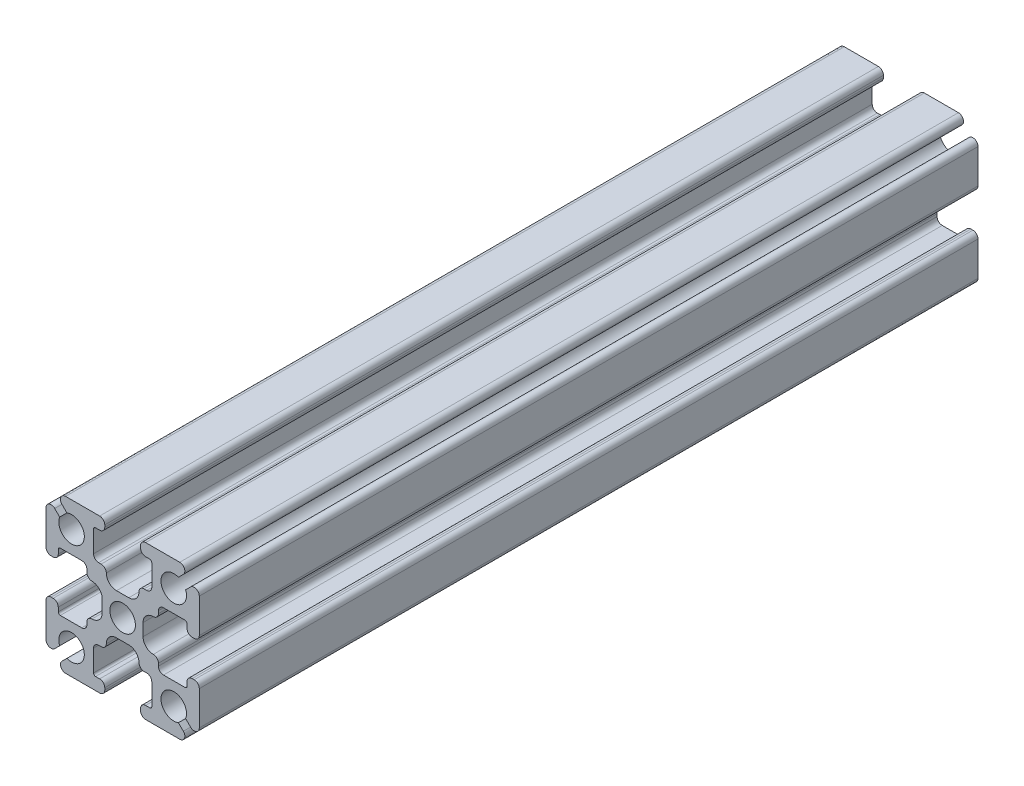
from build123d import *

# Parameters (mm, degrees)
SKETCH1_R           = 1.25
BOSS_EXTRUDE1_DEPTH = 76.2


with BuildPart() as part:
    # Sketch1 → Boss-Extrude1 (new body)
    with BuildSketch(Plane.XY):
        with BuildLine():
            Line((6.646446609, 5.939339828), (6.163645978, 5.456539197))
            ThreePointArc((6.163645978, 5.456539197), (4.116116524, 4.116116524), (5.456539197, 6.163645978))
            Line((5.456539197, 6.163645978), (5.939339828, 6.646446609))
            ThreePointArc((5.939339828, 6.646446609), (6.047726204, 7.191341716), (5.585786438, 7.5))
            Line((5.585786438, 7.5), (2.25, 7.5))
            ThreePointArc((2.25, 7.5), (1.896446609, 7.353553391), (1.75, 7))
            Line((1.75, 7), (1.75, 6.8))
            ThreePointArc((1.75, 6.8), (1.896446609, 6.446446609), (2.25, 6.3))
            Line((2.25, 6.3), (2.65, 6.3))
            ThreePointArc((2.65, 6.3), (2.791421356, 6.241421356), (2.85, 6.1))
            Line((2.85, 6.1), (2.85, 4))
            ThreePointArc((2.85, 4), (2.703553391, 3.646446609), (2.35, 3.5))
            Line((2.35, 3.5), (2.1, 3.5))
            ThreePointArc((2.1, 3.5), (1.746446609, 3.353553391), (1.6, 3))
            ThreePointArc((1.6, 3), (1.307106781, 2.292893219), (0.6, 2))
            Line((0.6, 2), (-0.6, 2))
            ThreePointArc((-0.6, 2), (-1.307106781, 2.292893219), (-1.6, 3))
            ThreePointArc((-1.6, 3), (-1.746446609, 3.353553391), (-2.1, 3.5))
            Line((-2.1, 3.5), (-2.35, 3.5))
            ThreePointArc((-2.35, 3.5), (-2.703553391, 3.646446609), (-2.85, 4))
            Line((-2.85, 4), (-2.85, 6.1))
            ThreePointArc((-2.85, 6.1), (-2.791421356, 6.241421356), (-2.65, 6.3))
            Line((-2.65, 6.3), (-2.25, 6.3))
            ThreePointArc((-2.25, 6.3), (-1.896446609, 6.446446609), (-1.75, 6.8))
            Line((-1.75, 6.8), (-1.75, 7))
            ThreePointArc((-1.75, 7), (-1.896446609, 7.353553391), (-2.25, 7.5))
            Line((-2.25, 7.5), (-5.585786438, 7.5))
            ThreePointArc((-5.585786438, 7.5), (-6.047726204, 7.191341716), (-5.939339828, 6.646446609))
            Line((-5.939339828, 6.646446609), (-5.456539197, 6.163645978))
            ThreePointArc((-5.456539197, 6.163645978), (-4.116116524, 4.116116524), (-6.163645978, 5.456539197))
            Line((-6.163645978, 5.456539197), (-6.646446609, 5.939339828))
            ThreePointArc((-6.646446609, 5.939339828), (-7.191341716, 6.047726204), (-7.5, 5.585786438))
            Line((-7.5, 5.585786438), (-7.5, 2.25))
            ThreePointArc((-7.5, 2.25), (-7.353553391, 1.896446609), (-7, 1.75))
            Line((-7, 1.75), (-6.8, 1.75))
            ThreePointArc((-6.8, 1.75), (-6.446446609, 1.896446609), (-6.3, 2.25))
            Line((-6.3, 2.25), (-6.3, 2.65))
            ThreePointArc((-6.3, 2.65), (-6.241421356, 2.791421356), (-6.1, 2.85))
            Line((-6.1, 2.85), (-4, 2.85))
            ThreePointArc((-4, 2.85), (-3.646446609, 2.703553391), (-3.5, 2.35))
            Line((-3.5, 2.35), (-3.5, 2.1))
            ThreePointArc((-3.5, 2.1), (-3.353553391, 1.746446609), (-3, 1.6))
            ThreePointArc((-3, 1.6), (-2.292893219, 1.307106781), (-2, 0.6))
            Line((-2, 0.6), (-2, -0.6))
            ThreePointArc((-2, -0.6), (-2.292893219, -1.307106781), (-3, -1.6))
            ThreePointArc((-3, -1.6), (-3.353553391, -1.746446609), (-3.5, -2.1))
            Line((-3.5, -2.1), (-3.5, -2.35))
            ThreePointArc((-3.5, -2.35), (-3.646446609, -2.703553391), (-4, -2.85))
            Line((-4, -2.85), (-6.1, -2.85))
            ThreePointArc((-6.1, -2.85), (-6.241421356, -2.791421356), (-6.3, -2.65))
            Line((-6.3, -2.65), (-6.3, -2.25))
            ThreePointArc((-6.3, -2.25), (-6.446446609, -1.896446609), (-6.8, -1.75))
            Line((-6.8, -1.75), (-7, -1.75))
            ThreePointArc((-7, -1.75), (-7.353553391, -1.896446609), (-7.5, -2.25))
            Line((-7.5, -2.25), (-7.5, -5.585786438))
            ThreePointArc((-7.5, -5.585786438), (-7.191341716, -6.047726204), (-6.646446609, -5.939339828))
            Line((-6.646446609, -5.939339828), (-6.163645978, -5.456539197))
            ThreePointArc((-6.163645978, -5.456539197), (-4.116116524, -4.116116524), (-5.456539197, -6.163645978))
            Line((-5.456539197, -6.163645978), (-5.939339828, -6.646446609))
            ThreePointArc((-5.939339828, -6.646446609), (-6.047726204, -7.191341716), (-5.585786438, -7.5))
            Line((-5.585786438, -7.5), (-2.25, -7.5))
            ThreePointArc((-2.25, -7.5), (-1.896446609, -7.353553391), (-1.75, -7))
            Line((-1.75, -7), (-1.75, -6.8))
            ThreePointArc((-1.75, -6.8), (-1.896446609, -6.446446609), (-2.25, -6.3))
            Line((-2.25, -6.3), (-2.65, -6.3))
            ThreePointArc((-2.65, -6.3), (-2.791421356, -6.241421356), (-2.85, -6.1))
            Line((-2.85, -6.1), (-2.85, -4))
            ThreePointArc((-2.85, -4), (-2.703553391, -3.646446609), (-2.35, -3.5))
            Line((-2.35, -3.5), (-2.1, -3.5))
            ThreePointArc((-2.1, -3.5), (-1.746446609, -3.353553391), (-1.6, -3))
            ThreePointArc((-1.6, -3), (-1.307106781, -2.292893219), (-0.6, -2))
            Line((-0.6, -2), (0.6, -2))
            ThreePointArc((0.6, -2), (1.307106781, -2.292893219), (1.6, -3))
            ThreePointArc((1.6, -3), (1.746446609, -3.353553391), (2.1, -3.5))
            Line((2.1, -3.5), (2.35, -3.5))
            ThreePointArc((2.35, -3.5), (2.703553391, -3.646446609), (2.85, -4))
            Line((2.85, -4), (2.85, -6.1))
            ThreePointArc((2.85, -6.1), (2.791421356, -6.241421356), (2.65, -6.3))
            Line((2.65, -6.3), (2.25, -6.3))
            ThreePointArc((2.25, -6.3), (1.896446609, -6.446446609), (1.75, -6.8))
            Line((1.75, -6.8), (1.75, -7))
            ThreePointArc((1.75, -7), (1.896446609, -7.353553391), (2.25, -7.5))
            Line((2.25, -7.5), (5.585786438, -7.5))
            ThreePointArc((5.585786438, -7.5), (6.047726204, -7.191341716), (5.939339828, -6.646446609))
            Line((5.939339828, -6.646446609), (5.456539197, -6.163645978))
            ThreePointArc((5.456539197, -6.163645978), (4.116116524, -4.116116524), (6.163645978, -5.456539197))
            Line((6.163645978, -5.456539197), (6.646446609, -5.939339828))
            ThreePointArc((6.646446609, -5.939339828), (7.191341716, -6.047726204), (7.5, -5.585786438))
            Line((7.5, -5.585786438), (7.5, -2.25))
            ThreePointArc((7.5, -2.25), (7.353553391, -1.896446609), (7, -1.75))
            Line((7, -1.75), (6.8, -1.75))
            ThreePointArc((6.8, -1.75), (6.446446609, -1.896446609), (6.3, -2.25))
            Line((6.3, -2.25), (6.3, -2.65))
            ThreePointArc((6.3, -2.65), (6.241421356, -2.791421356), (6.1, -2.85))
            Line((6.1, -2.85), (4, -2.85))
            ThreePointArc((4, -2.85), (3.646446609, -2.703553391), (3.5, -2.35))
            Line((3.5, -2.35), (3.5, -2.1))
            ThreePointArc((3.5, -2.1), (3.353553391, -1.746446609), (3, -1.6))
            ThreePointArc((3, -1.6), (2.292893219, -1.307106781), (2, -0.6))
            Line((2, -0.6), (2, 0.6))
            ThreePointArc((2, 0.6), (2.292893219, 1.307106781), (3, 1.6))
            ThreePointArc((3, 1.6), (3.353553391, 1.746446609), (3.5, 2.1))
            Line((3.5, 2.1), (3.5, 2.35))
            ThreePointArc((3.5, 2.35), (3.646446609, 2.703553391), (4, 2.85))
            Line((4, 2.85), (6.1, 2.85))
            ThreePointArc((6.1, 2.85), (6.241421356, 2.791421356), (6.3, 2.65))
            Line((6.3, 2.65), (6.3, 2.25))
            ThreePointArc((6.3, 2.25), (6.446446609, 1.896446609), (6.8, 1.75))
            Line((6.8, 1.75), (7, 1.75))
            ThreePointArc((7, 1.75), (7.353553391, 1.896446609), (7.5, 2.25))
            Line((7.5, 2.25), (7.5, 5.585786438))
            ThreePointArc((7.5, 5.585786438), (7.191341716, 6.047726204), (6.646446609, 5.939339828))
        make_face()
        with Locations(Location((0, 0, 0), (0, 0, 180))):
            Circle(SKETCH1_R, mode=Mode.SUBTRACT)
    extrude(amount=BOSS_EXTRUDE1_DEPTH)


solid = part.part
